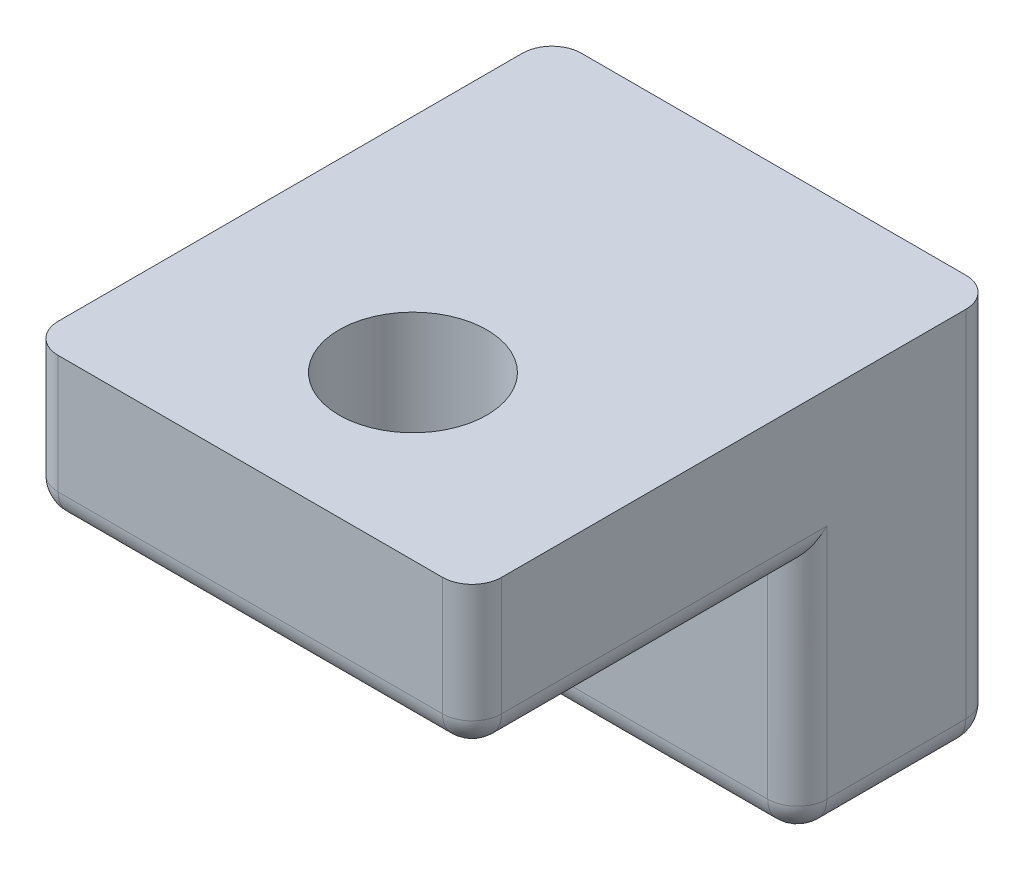
from build123d import *

# Parameters (mm, degrees)
BOSS_EXTRUDE1_DEPTH = 7.5
CUT_EXTRUDE1_REACH  = 20.608
SKETCH2_R           = 2.5
FILLET1_R           = 1


with BuildPart() as part:
    # Sketch1 → Boss-Extrude1 (new, symmetric)
    with BuildSketch(Plane(origin=(0, 0, 0), x_dir=(0, 0, -1), z_dir=(1, 0, 0))):
        Polygon((0, 0), (0, 8), (-11, 8), (-11, 13), (6.7, 13), (6.7, 0), align=None)
    extrude(amount=BOSS_EXTRUDE1_DEPTH, both=True)

    # Sketch2 → Cut-Extrude1 (cut, up to next)
    with BuildSketch(Plane(origin=(0, 13, 0), x_dir=(1, 0, 0), z_dir=(0, 1, 0)), mode=Mode.PRIVATE) as cut_extrude1_sk1:
        with Locations(Location((0, -5.5, 0), (0, 0, 270))):
            Circle(SKETCH2_R)
    cut_extrude1_tool1 = extrude(cut_extrude1_sk1.sketch, amount=-CUT_EXTRUDE1_REACH, mode=Mode.PRIVATE) & part.part
    add(cut_extrude1_tool1.solids().sort_by_distance((0, 13, 5.5))[0], mode=Mode.SUBTRACT)

    # Fillet1
    fillet1_edges = [part.edges().sort_by_distance(p)[0] for p in [
        (0, 0, 0),
        (0, 8, 11),
        (0, 0, -6.7),
        (7.5, 10.5, 11),
        (7.5, 8, 5.5),
        (7.5, 4, 0),
        (7.5, 0, -3.35),
        (-7.5, 4, 0),
        (-7.5, 8, 5.5),
        (-7.5, 10.5, 11),
        (-7.5, 6.5, -6.7),
        (-7.5, 0, -3.35),
        (7.5, 6.5, -6.7),
    ]]
    fillet(fillet1_edges, radius=FILLET1_R)


solid = part.part
